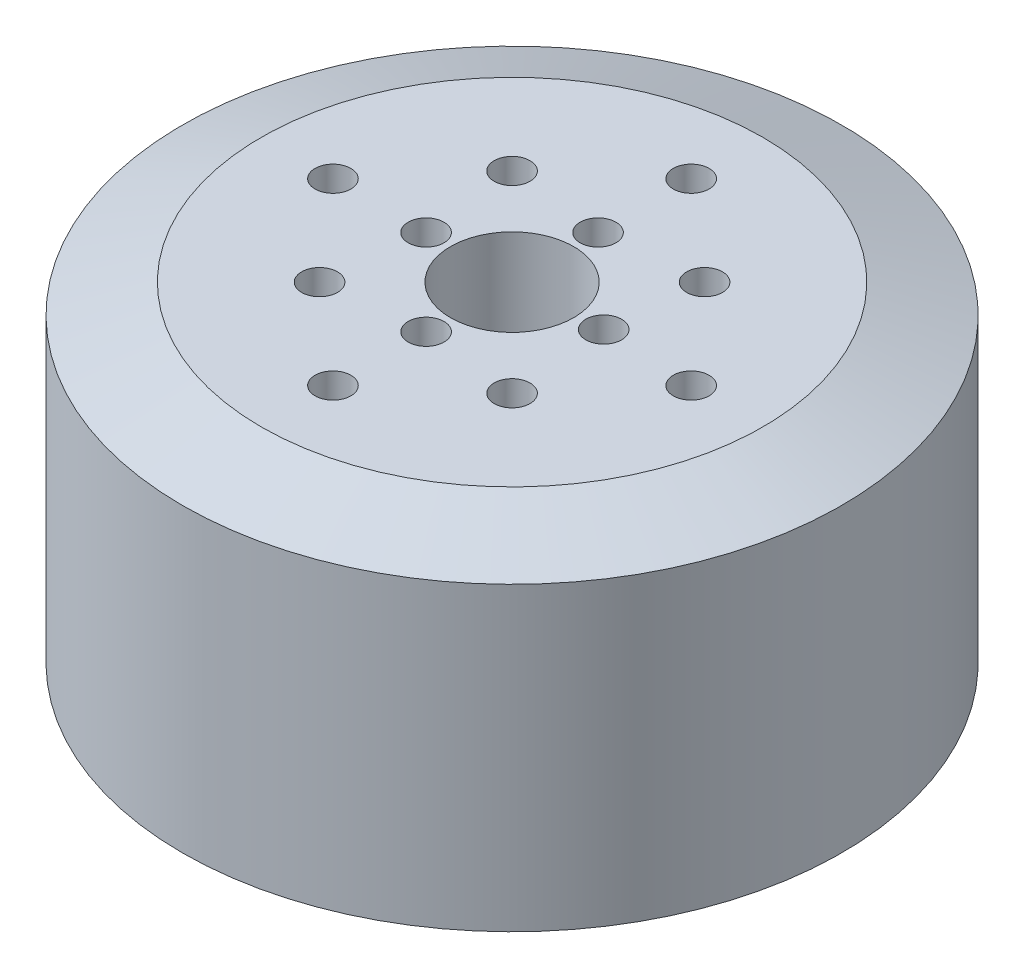
from build123d import *

# Parameters (mm, degrees)
SKETCH_1_R          = 23
EXTRUDE_1_DEPTH     = 23
CHAMFER_1_SIZE      = 2
CHAMFER_1_SIZE2     = 5.494954839
SKETCH_2_R          = 3.5
CUT_EXTRUDE_1_DEPTH = 40.837168574
SKETCH_2_3_R        = 5
SKETCH_2_3_R_2      = 3.5
EXTRUDE_2_DEPTH     = 32
CUT_EXTRUDE_START   = -19
SKETCH_4_R          = 21
SKETCH_4_R_2        = 5
CUT_EXTRUDE_2_DEPTH = 19
M3X0_51_D           = 2.5
M3X0_52_D           = 2.5
M3X0_52_DEPTH       = 7.5
M3X0_52_TIP         = 0.751075774
M3X0_53_D           = 2.5
SKETCH_12_R         = 4.3
CUT_EXTRUDE_3_DEPTH = 25


with BuildPart() as part:
    # Эскиз1 → Бобышка-Вытянуть1 (new body)
    with BuildSketch(Plane(origin=(0, 0, 0), x_dir=(1, 0, 0), z_dir=(0, 1, 0))):
        Circle(SKETCH_1_R)
    extrude(amount=EXTRUDE_1_DEPTH)

    # Фаска1
    chamfer_1_edges = [part.edges().sort_by_distance(p)[0] for p in [
        (-23, 23, 0),
    ]]
    chamfer_1_side = [part.faces().sort_by_distance(p)[0] for p in [
        (-23, 11.5, 0),
    ]]
    chamfer(chamfer_1_edges, length=CHAMFER_1_SIZE, length2=CHAMFER_1_SIZE2, reference=chamfer_1_side[0])

    # Эскиз2 → Вырез-Вытянуть1 (cut, through all)
    with BuildSketch(Plane(origin=(0, 23, 0), x_dir=(1, 0, 0), z_dir=(0, 1, 0))):
        Circle(SKETCH_2_R)
    extrude(amount=-CUT_EXTRUDE_1_DEPTH, mode=Mode.SUBTRACT)

    # Эскиз2<3> → Бобышка-Вытянуть2 (add)
    with BuildSketch(Plane(origin=(0, 23, 0), x_dir=(1, 0, 0), z_dir=(0, 1, 0))):
        Circle(SKETCH_2_3_R)
        Circle(SKETCH_2_3_R_2, mode=Mode.SUBTRACT)
    extrude(amount=-EXTRUDE_2_DEPTH)

    # Эскиз4 → Вырез-Вытянуть2 (cut)
    with BuildSketch(Plane.XZ.offset(CUT_EXTRUDE_START)):
        Circle(SKETCH_4_R)
        Circle(SKETCH_4_R_2, mode=Mode.SUBTRACT)
    extrude(amount=CUT_EXTRUDE_2_DEPTH, mode=Mode.SUBTRACT)

    # Отверстие обработанное метчиком M3x0.51 (through all)
    with Locations(Plane(origin=(0, 23, 0), x_dir=(1, 0, 0), z_dir=(0, 1, 0))):
        with Locations((0, 12.5), (12.5, 0), (0, -12.5), (-12.5, 0)):
            Hole(M3X0_51_D / 2)

    # Отверстие обработанное метчиком M3x0.52
    with Locations(Plane(origin=(0, 23, 0), x_dir=(1, 0, 0), z_dir=(0, 1, 0))):
        with Locations((6.062159206, 0.332038968), (0, 6), (-6, 0), (0, -6)):
            Hole(M3X0_52_D / 2, depth=M3X0_52_DEPTH)
            with Locations((0, 0, -(M3X0_52_DEPTH + M3X0_52_TIP / 2))):  # 118° drill point
                Cone(0, M3X0_52_D / 2, M3X0_52_TIP, mode=Mode.SUBTRACT)

    # Отверстие обработанное метчиком M3x0.53 (through all)
    with Locations(Plane(origin=(0, 23, 0), x_dir=(1, 0, 0), z_dir=(0, 1, 0))):
        with Locations((-6.717514421, 6.717514421), (6.717514421, 6.717514421), (6.717514421, -6.717514421), (-6.717514421, -6.717514421)):
            Hole(M3X0_53_D / 2)

    # Эскиз12 → Вырез-Вытянуть3 (cut)
    with BuildSketch(Plane(origin=(0, 23, 0), x_dir=(1, 0, 0), z_dir=(0, 1, 0))):
        Circle(SKETCH_12_R)
    extrude(amount=-CUT_EXTRUDE_3_DEPTH, mode=Mode.SUBTRACT)


solid = part.part
